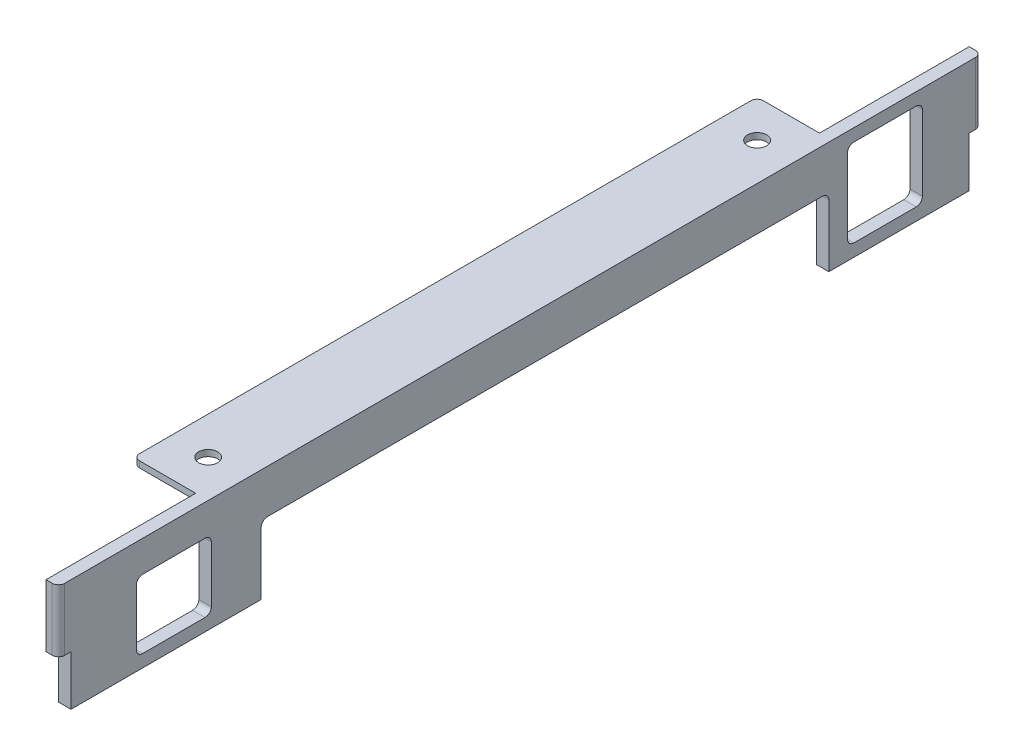
from build123d import *

# Parameters (mm, degrees)
SKETCH_1_W          = 2
SKETCH_1_H          = 18
EXTRUDE_1_DEPTH     = 148
SKETCH_4_W          = 2
SKETCH_4_H          = 8
CUT_EXTRUDE_1_DEPTH = 150.103990557
SKETCH_8_W          = 100
SKETCH_8_H          = 1
EXTRUDE_5_DEPTH     = 10
SKETCH_9_R          = 1.525
CUT_EXTRUDE_3_DEPTH = 150.425566755
SKETCH_10_W         = 12
SKETCH_10_H         = 14
SKETCH_10_W_2       = 91
SKETCH_10_H_2       = 11
CUT_EXTRUDE_4_DEPTH = 150.572724786
FILLET_1_R          = 1
FILLET_2_R          = 1
FILLET_3_R          = 1
FILLET_4_R          = 1
FILLET_5_R          = 1
FILLET_7_R          = 1


with BuildPart() as part:
    # 草图1 → 凸台-拉伸1 (new body)
    with BuildSketch(Plane.XY):
        with Locations((1, 9)):
            Rectangle(SKETCH_1_W, SKETCH_1_H)
    extrude(amount=EXTRUDE_1_DEPTH)

    # 草图4 → 切除-拉伸1 (cut, through all)
    with BuildSketch(Plane(origin=(2, 0, 0), x_dir=(0, 0, -1), z_dir=(1, 0, 0))):
        with Locations((-1, 4)):
            Rectangle(SKETCH_4_W, SKETCH_4_H)
        with Locations((-147, 4)):
            Rectangle(SKETCH_4_W, SKETCH_4_H)
    extrude(amount=-CUT_EXTRUDE_1_DEPTH, mode=Mode.SUBTRACT)

    # 草图8 → 凸台-拉伸5 (add)
    with BuildSketch(Plane.ZY):
        with Locations((74, 17.5)):
            Rectangle(SKETCH_8_W, SKETCH_8_H)
    extrude(amount=EXTRUDE_5_DEPTH)

    # 草图9 → 切除-拉伸3 (cut, through all)
    with BuildSketch(Plane(origin=(0, 18, 0), x_dir=(1, 0, 0), z_dir=(0, 1, 0))):
        with Locations(Location((-4, -30, 0), (0, 0, 270))):
            Circle(SKETCH_9_R)
        with Locations(Location((-4, -118, 0), (0, 0, 270))):
            Circle(SKETCH_9_R)
    extrude(amount=-CUT_EXTRUDE_3_DEPTH, mode=Mode.SUBTRACT)

    # 草图10 → 切除-拉伸4 (cut, through all)
    with BuildSketch(Plane(origin=(2, 0, 0), x_dir=(0, 0, -1), z_dir=(1, 0, 0))):
        with Locations((-15.5, 9)):
            Rectangle(SKETCH_10_W, SKETCH_10_H)
        with Locations((-70, 5.5)):
            Rectangle(SKETCH_10_W_2, SKETCH_10_H_2)
        with Locations((-129.5, 7.5)):
            Rectangle(SKETCH_10_W, SKETCH_10_H_2)
    extrude(amount=-CUT_EXTRUDE_4_DEPTH, mode=Mode.SUBTRACT)

    # 圆角1
    fillet_1_edges = [part.edges().sort_by_distance(p)[0] for p in [
        (-10, 17.5, 24),
        (-10, 17.5, 124),
    ]]
    fillet(fillet_1_edges, radius=FILLET_1_R)

    # 圆角2
    fillet_2_edges = [part.edges().sort_by_distance(p)[0] for p in [
        (1, 11, 115.5),
        (1, 11, 24.5),
    ]]
    fillet(fillet_2_edges, radius=FILLET_2_R)

    # 圆角3
    fillet_3_edges = [part.edges().sort_by_distance(p)[0] for p in [
        (1, 2, 21.5),
        (1, 16, 21.5),
        (1, 16, 9.5),
        (1, 2, 9.5),
    ]]
    fillet(fillet_3_edges, radius=FILLET_3_R)

    # 圆角4
    fillet_4_edges = [part.edges().sort_by_distance(p)[0] for p in [
        (1, 13, 123.5),
        (1, 2, 123.5),
        (1, 2, 135.5),
        (1, 13, 135.5),
    ]]
    fillet(fillet_4_edges, radius=FILLET_4_R)

    # 圆角5
    fillet_5_edges = [part.edges().sort_by_distance(p)[0] for p in [
        (2, 13, 148),
    ]]
    fillet(fillet_5_edges, radius=FILLET_5_R)

    # 圆角7
    fillet_7_edges = [part.edges().sort_by_distance(p)[0] for p in [
        (2, 13, 0),
    ]]
    fillet(fillet_7_edges, radius=FILLET_7_R)


solid = part.part
